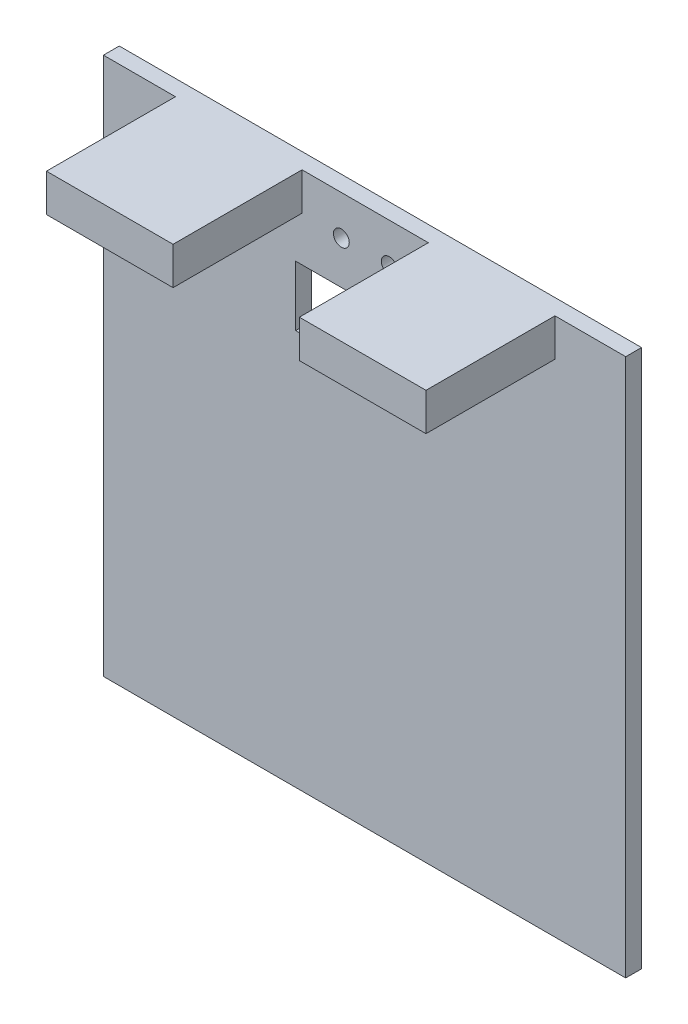
from build123d import *

# Parameters (mm, degrees)
SKETCH1_W           = 66
SKETCH1_H           = 68
SKETCH1_R           = 1
SKETCH1_W_2         = 17.8
SKETCH1_H_2         = 7.6
BOSS_EXTRUDE1_DEPTH = 2
SKETCH2_W           = 16
SKETCH2_H           = 4.75
BOSS_EXTRUDE2_DEPTH = 16.3


with BuildPart() as part:
    # Sketch1 → Boss-Extrude1 (new body)
    with BuildSketch(Plane.XY.offset(30)):
        with Locations((251.940861289, 301.024014524)):
            Rectangle(SKETCH1_W, SKETCH1_H)
        with Locations((249.003592831, 330.031505481)):
            Circle(SKETCH1_R, mode=Mode.SUBTRACT)
        with Locations((255.055282531, 330.031505481)):
            Circle(SKETCH1_R, mode=Mode.SUBTRACT)
        with Locations((252.135035756, 320.823888471)):
            Rectangle(SKETCH1_W_2, SKETCH1_H_2, mode=Mode.SUBTRACT)
    extrude(amount=BOSS_EXTRUDE1_DEPTH)

    # Sketch2 → Boss-Extrude2 (add)
    with BuildSketch(Plane.XY.offset(32)):
        with Locations((236.037971242, 332.649014524)):
            Rectangle(SKETCH2_W, SKETCH2_H)
        with Locations((268, 332.649014524)):
            Rectangle(SKETCH2_W, SKETCH2_H)
    extrude(amount=BOSS_EXTRUDE2_DEPTH)


solid = part.part
